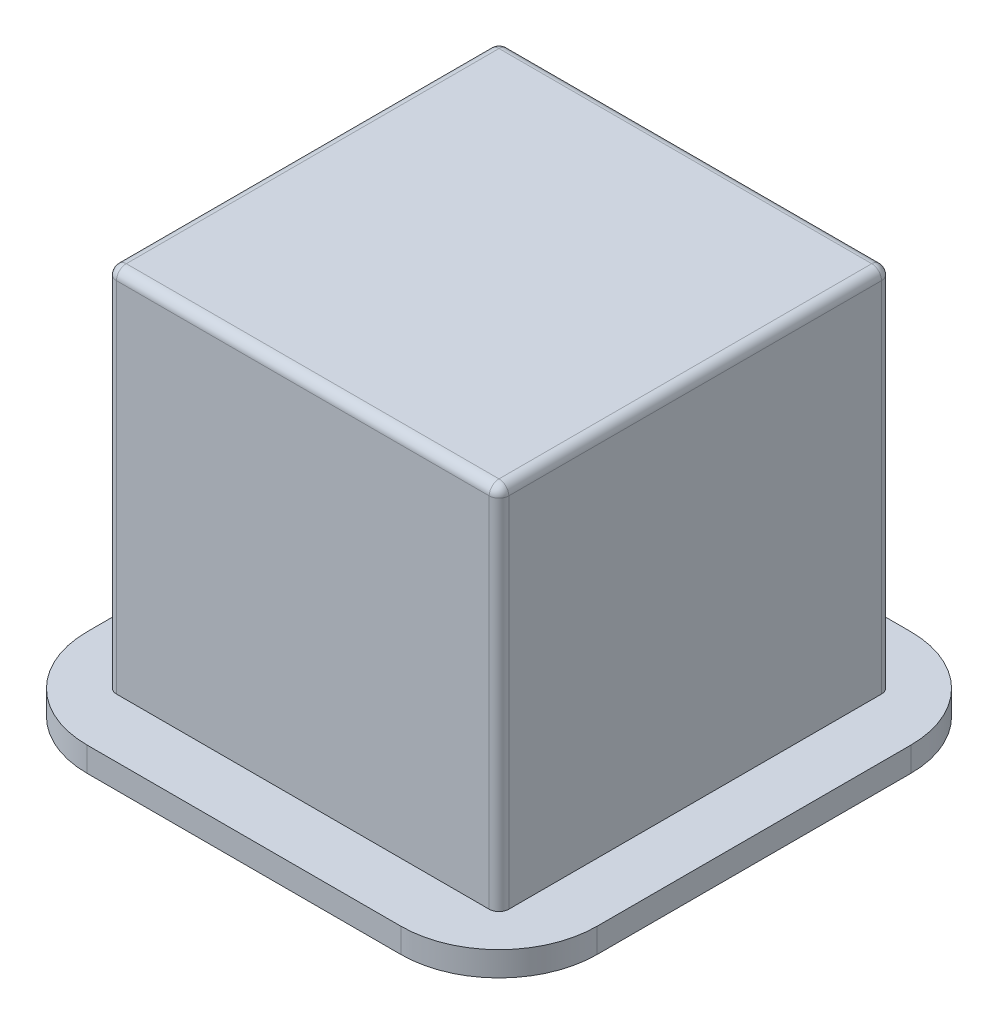
from build123d import *

# Parameters (mm, degrees)
SKETCH1_W           = 200
SKETCH1_H           = 200
BOSS_EXTRUDE1_DEPTH = 200
SKETCH3_W           = 200
SKETCH3_H           = 12.5
BOSS_EXTRUDE2_DEPTH = 30
SKETCH4_W           = 230
SKETCH4_H           = 12.5
BOSS_EXTRUDE3_DEPTH = 30
SKETCH5_W           = 230
SKETCH5_H           = 12.5
BOSS_EXTRUDE4_DEPTH = 30
SKETCH6_W           = 260
SKETCH6_H           = 12.5
BOSS_EXTRUDE5_DEPTH = 30
FILLET1_R           = 50
FILLET2_R           = 5


with BuildPart() as part:
    # Sketch1 → Boss-Extrude1 (new body)
    with BuildSketch(Plane(origin=(0, 0, 0), x_dir=(1, 0, 0), z_dir=(0, 1, 0))):
        with Locations((100, 100)):
            Rectangle(SKETCH1_W, SKETCH1_H)
    extrude(amount=BOSS_EXTRUDE1_DEPTH)

    # Sketch3 → Boss-Extrude2 (add)
    with BuildSketch(Plane.XY):
        with Locations((100, 6.25)):
            Rectangle(SKETCH3_W, SKETCH3_H)
    extrude(amount=BOSS_EXTRUDE2_DEPTH)

    # Sketch4 → Boss-Extrude3 (add)
    with BuildSketch(Plane(origin=(200, 0, 0), x_dir=(0, 0, -1), z_dir=(1, 0, 0))):
        with Locations((85, 6.25)):
            Rectangle(SKETCH4_W, SKETCH4_H)
    extrude(amount=BOSS_EXTRUDE3_DEPTH)

    # Sketch5 → Boss-Extrude4 (add)
    with BuildSketch(Plane(origin=(0, 0, -200), x_dir=(-1, 0, 0), z_dir=(0, 0, -1))):
        with Locations((-115, 6.25)):
            Rectangle(SKETCH5_W, SKETCH5_H)
    extrude(amount=BOSS_EXTRUDE4_DEPTH)

    # Sketch6 → Boss-Extrude5 (add)
    with BuildSketch(Plane.ZY):
        with Locations((-100, 6.25)):
            Rectangle(SKETCH6_W, SKETCH6_H)
    extrude(amount=BOSS_EXTRUDE5_DEPTH)

    # Fillet1
    fillet1_edges = [part.edges().sort_by_distance(p)[0] for p in [
        (230, 6.25, 30),
        (230, 6.25, -230),
        (-30, 6.25, -230),
        (-30, 6.25, 30),
    ]]
    fillet(fillet1_edges, radius=FILLET1_R)

    # Fillet2
    fillet2_edges = [part.edges().sort_by_distance(p)[0] for p in [
        (200, 200, -100),
        (100, 200, -200),
        (0, 200, -100),
        (100, 200, 0),
        (0, 106.25, -200),
        (200, 106.25, -200),
        (200, 106.25, 0),
        (0, 106.25, 0),
    ]]
    fillet(fillet2_edges, radius=FILLET2_R)


solid = part.part
